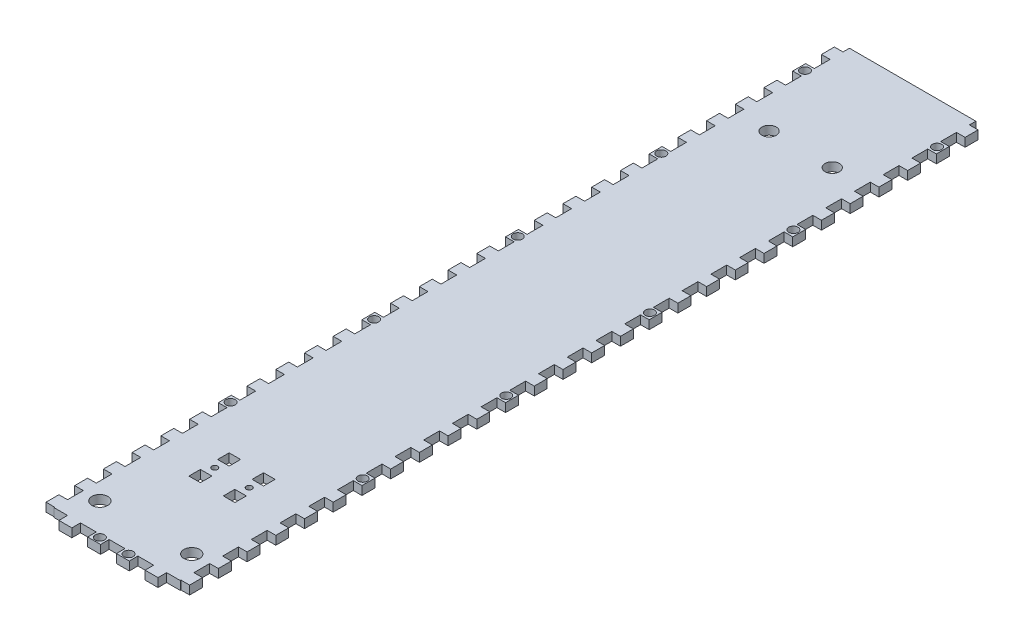
from build123d import *

# Parameters (mm, degrees)
SKETCH1_W           = 44
SKETCH1_H           = 3
BOSS_EXTRUDE1_DEPTH = 277
SKETCH4_W           = 4.5
SKETCH4_H           = 3
BOSS_EXTRUDE2_DEPTH = 3
SKETCH5_W           = 4.5
SKETCH5_H           = 3
BOSS_EXTRUDE3_DEPTH = 3
SKETCH6_W           = 4.5
SKETCH6_H           = 3
BOSS_EXTRUDE4_DEPTH = 3
SKETCH7_R           = 1.6
CUT_EXTRUDE1_DEPTH  = 3
SKETCH8_R           = 2.5
CUT_EXTRUDE2_DEPTH  = 12
SKETCH9_R           = 1.6
CUT_EXTRUDE3_DEPTH  = 12
SKETCH11_R          = 1
SKETCH11_W          = 4
SKETCH11_H          = 4
CUT_EXTRUDE4_DEPTH  = 10
SKETCH12_R          = 2.75
CUT_EXTRUDE5_DEPTH  = 10
SKETCH7_2_R         = 1.6
BOSS_EXTRUDE5_DEPTH = 3


with BuildPart() as part:
    # Sketch1 → Boss-Extrude1 (new body)
    with BuildSketch(Plane.XY):
        with Locations((-8.02006689, 9.02173913)):
            Rectangle(SKETCH1_W, SKETCH1_H)
    extrude(amount=BOSS_EXTRUDE1_DEPTH)

    # Sketch4 → Boss-Extrude2 (add)
    with BuildSketch(Plane(origin=(13.97993311, 0, 0), x_dir=(0, 0, -1), z_dir=(1, 0, 0))):
        with Locations((-274.5, 9.02173913)):
            Rectangle(SKETCH4_W, SKETCH4_H)
        with Locations((-264.5, 9.02173913)):
            Rectangle(SKETCH4_W, SKETCH4_H)
        with Locations((-254.5, 9.02173913)):
            Rectangle(SKETCH4_W, SKETCH4_H)
        with Locations((-244.5, 9.02173913)):
            Rectangle(SKETCH4_W, SKETCH4_H)
        with Locations((-234.5, 9.02173913)):
            Rectangle(SKETCH4_W, SKETCH4_H)
        with Locations((-224.5, 9.02173913)):
            Rectangle(SKETCH4_W, SKETCH4_H)
        with Locations((-214.5, 9.02173913)):
            Rectangle(SKETCH4_W, SKETCH4_H)
        with Locations((-204.5, 9.02173913)):
            Rectangle(SKETCH4_W, SKETCH4_H)
        with Locations((-194.5, 9.02173913)):
            Rectangle(SKETCH4_W, SKETCH4_H)
        with Locations((-184.5, 9.02173913)):
            Rectangle(SKETCH4_W, SKETCH4_H)
        with Locations((-174.5, 9.02173913)):
            Rectangle(SKETCH4_W, SKETCH4_H)
        with Locations((-164.5, 9.02173913)):
            Rectangle(SKETCH4_W, SKETCH4_H)
        with Locations((-154.5, 9.02173913)):
            Rectangle(SKETCH4_W, SKETCH4_H)
        with Locations((-144.5, 9.02173913)):
            Rectangle(SKETCH4_W, SKETCH4_H)
        with Locations((-134.5, 9.02173913)):
            Rectangle(SKETCH4_W, SKETCH4_H)
        with Locations((-124.5, 9.02173913)):
            Rectangle(SKETCH4_W, SKETCH4_H)
        with Locations((-114.5, 9.02173913)):
            Rectangle(SKETCH4_W, SKETCH4_H)
        with Locations((-104.5, 9.02173913)):
            Rectangle(SKETCH4_W, SKETCH4_H)
        with Locations((-94.5, 9.02173913)):
            Rectangle(SKETCH4_W, SKETCH4_H)
        with Locations((-84.5, 9.02173913)):
            Rectangle(SKETCH4_W, SKETCH4_H)
        with Locations((-74.5, 9.02173913)):
            Rectangle(SKETCH4_W, SKETCH4_H)
        with Locations((-64.5, 9.02173913)):
            Rectangle(SKETCH4_W, SKETCH4_H)
        with Locations((-54.5, 9.02173913)):
            Rectangle(SKETCH4_W, SKETCH4_H)
        with Locations((-44.5, 9.02173913)):
            Rectangle(SKETCH4_W, SKETCH4_H)
        with Locations((-34.5, 9.02173913)):
            Rectangle(SKETCH4_W, SKETCH4_H)
        with Locations((-24.5, 9.02173913)):
            Rectangle(SKETCH4_W, SKETCH4_H)
        with Locations((-14.5, 9.02173913)):
            Rectangle(SKETCH4_W, SKETCH4_H)
        with Locations((-4.5, 9.02173913)):
            Rectangle(SKETCH4_W, SKETCH4_H)
    extrude(amount=BOSS_EXTRUDE2_DEPTH)

    # Sketch5 → Boss-Extrude3 (add)
    with BuildSketch(Plane.ZY.offset(30.02006689)):
        with Locations((274.5, 9.02173913)):
            Rectangle(SKETCH5_W, SKETCH5_H)
        with Locations((264.5, 9.02173913)):
            Rectangle(SKETCH5_W, SKETCH5_H)
        with Locations((254.5, 9.02173913)):
            Rectangle(SKETCH5_W, SKETCH5_H)
        with Locations((244.5, 9.02173913)):
            Rectangle(SKETCH5_W, SKETCH5_H)
        with Locations((234.5, 9.02173913)):
            Rectangle(SKETCH5_W, SKETCH5_H)
        with Locations((224.5, 9.02173913)):
            Rectangle(SKETCH5_W, SKETCH5_H)
        with Locations((214.5, 9.02173913)):
            Rectangle(SKETCH5_W, SKETCH5_H)
        with Locations((204.5, 9.02173913)):
            Rectangle(SKETCH5_W, SKETCH5_H)
        with Locations((194.5, 9.02173913)):
            Rectangle(SKETCH5_W, SKETCH5_H)
        with Locations((184.5, 9.02173913)):
            Rectangle(SKETCH5_W, SKETCH5_H)
        with Locations((174.5, 9.02173913)):
            Rectangle(SKETCH5_W, SKETCH5_H)
        with Locations((164.5, 9.02173913)):
            Rectangle(SKETCH5_W, SKETCH5_H)
        with Locations((154.5, 9.02173913)):
            Rectangle(SKETCH5_W, SKETCH5_H)
        with Locations((144.5, 9.02173913)):
            Rectangle(SKETCH5_W, SKETCH5_H)
        with Locations((134.5, 9.02173913)):
            Rectangle(SKETCH5_W, SKETCH5_H)
        with Locations((124.5, 9.02173913)):
            Rectangle(SKETCH5_W, SKETCH5_H)
        with Locations((114.5, 9.02173913)):
            Rectangle(SKETCH5_W, SKETCH5_H)
        with Locations((104.5, 9.02173913)):
            Rectangle(SKETCH5_W, SKETCH5_H)
        with Locations((94.5, 9.02173913)):
            Rectangle(SKETCH5_W, SKETCH5_H)
        with Locations((84.5, 9.02173913)):
            Rectangle(SKETCH5_W, SKETCH5_H)
        with Locations((74.5, 9.02173913)):
            Rectangle(SKETCH5_W, SKETCH5_H)
        with Locations((64.5, 9.02173913)):
            Rectangle(SKETCH5_W, SKETCH5_H)
        with Locations((54.5, 9.02173913)):
            Rectangle(SKETCH5_W, SKETCH5_H)
        with Locations((44.5, 9.02173913)):
            Rectangle(SKETCH5_W, SKETCH5_H)
        with Locations((34.5, 9.02173913)):
            Rectangle(SKETCH5_W, SKETCH5_H)
        with Locations((24.5, 9.02173913)):
            Rectangle(SKETCH5_W, SKETCH5_H)
        with Locations((14.5, 9.02173913)):
            Rectangle(SKETCH5_W, SKETCH5_H)
        with Locations((4.5, 9.02173913)):
            Rectangle(SKETCH5_W, SKETCH5_H)
    extrude(amount=BOSS_EXTRUDE3_DEPTH)

    # Sketch6 → Boss-Extrude4 (add)
    with BuildSketch(Plane.XY.offset(277)):
        with Locations((-23.02006689, 9.02173913)):
            Rectangle(SKETCH6_W, SKETCH6_H)
        with Locations((-13.02006689, 9.02173913)):
            Rectangle(SKETCH6_W, SKETCH6_H)
        with Locations((-3.02006689, 9.02173913)):
            Rectangle(SKETCH6_W, SKETCH6_H)
        with Locations((6.97993311, 9.02173913)):
            Rectangle(SKETCH6_W, SKETCH6_H)
    extrude(amount=BOSS_EXTRUDE4_DEPTH)

    # Sketch7 → Cut-Extrude1 (cut)
    with BuildSketch(Plane.XZ.offset(-7.52173913)):
        with Locations(Location((14.97993311, 264.5, 0), (0, 0, 270))):
            Circle(SKETCH7_R)
        with Locations(Location((-31.02006689, 264.5, 0), (0, 0, 90))):
            Circle(SKETCH7_R)
        with Locations(Location((-31.02006689, 214.5, 0), (0, 0, 90))):
            Circle(SKETCH7_R)
        with Locations(Location((14.97993311, 214.5, 0), (0, 0, 270))):
            Circle(SKETCH7_R)
        with Locations(Location((-31.02006689, 164.5, 0), (0, 0, 90))):
            Circle(SKETCH7_R)
        with Locations(Location((14.97993311, 164.5, 0), (0, 0, 270))):
            Circle(SKETCH7_R)
        with Locations(Location((-31.02006689, 114.5, 0), (0, 0, 90))):
            Circle(SKETCH7_R)
        with Locations(Location((14.97993311, 114.5, 0), (0, 0, 270))):
            Circle(SKETCH7_R)
        with Locations(Location((-31.02006689, 64.5, 0), (0, 0, 90))):
            Circle(SKETCH7_R)
        with Locations(Location((14.97993311, 64.5, 0), (0, 0, 270))):
            Circle(SKETCH7_R)
        with Locations(Location((-31.02006689, 14.5, 0), (0, 0, 90))):
            Circle(SKETCH7_R)
        with Locations(Location((14.97993311, 14.5, 0), (0, 0, 270))):
            Circle(SKETCH7_R)
    extrude(amount=-CUT_EXTRUDE1_DEPTH, mode=Mode.SUBTRACT)

    # Sketch8 → Cut-Extrude2 (cut)
    with BuildSketch(Plane.XZ.offset(-7.52173913)):
        with Locations(Location((-19.02006689, 39, 0), (0, 0, 270))):
            Circle(SKETCH8_R)
        with Locations(Location((2.97993311, 39, 0), (0, 0, 270))):
            Circle(SKETCH8_R)
    extrude(amount=-CUT_EXTRUDE2_DEPTH, mode=Mode.SUBTRACT)

    # Sketch9 → Cut-Extrude3 (cut)
    with BuildSketch(Plane(origin=(0, 7.52173913, 0), x_dir=(-1, 0, 0), z_dir=(0, -1, 0))):
        with Locations(Location((13.02006689, -278, 0), (0, 0, 90))):
            Circle(SKETCH9_R)
        with Locations(Location((3.02006689, -278, 0), (0, 0, 90))):
            Circle(SKETCH9_R)
    extrude(amount=-CUT_EXTRUDE3_DEPTH, mode=Mode.SUBTRACT)

    # Sketch11 → Cut-Extrude4 (cut)
    with BuildSketch(Plane.XZ.offset(-7.52173913)):
        with Locations(Location((-14.02006689, 237, 0), (0, 0, 270))):
            Circle(SKETCH11_R)
        with Locations(Location((-2.02006689, 237, 0), (0, 0, 270))):
            Circle(SKETCH11_R)
        with Locations((-14.02006689, 242)):
            Rectangle(SKETCH11_W, SKETCH11_H)
        with Locations((-14.02006689, 232)):
            Rectangle(SKETCH11_W, SKETCH11_H)
        with Locations((-2.02006689, 242)):
            Rectangle(SKETCH11_W, SKETCH11_H)
        with Locations((-2.02006689, 232)):
            Rectangle(SKETCH11_W, SKETCH11_H)
    extrude(amount=-CUT_EXTRUDE4_DEPTH, mode=Mode.SUBTRACT)

    # Sketch12 → Cut-Extrude5 (cut)
    with BuildSketch(Plane.XZ.offset(-7.52173913)):
        with Locations(Location((-24.02006689, 267, 0), (0, 0, 270))):
            Circle(SKETCH12_R)
        with Locations(Location((7.97993311, 267, 0), (0, 0, 270))):
            Circle(SKETCH12_R)
    extrude(amount=-CUT_EXTRUDE5_DEPTH, mode=Mode.SUBTRACT)

    # Sketch7<2> → Boss-Extrude5 (add, through all)
    with BuildSketch(Plane.XZ.offset(-7.52173913)):
        with Locations((-31.02006689, 264.5)):
            Circle(SKETCH7_2_R)
        with Locations((14.97993311, 264.5)):
            Circle(SKETCH7_2_R)
    extrude(amount=-BOSS_EXTRUDE5_DEPTH)


solid = part.part
